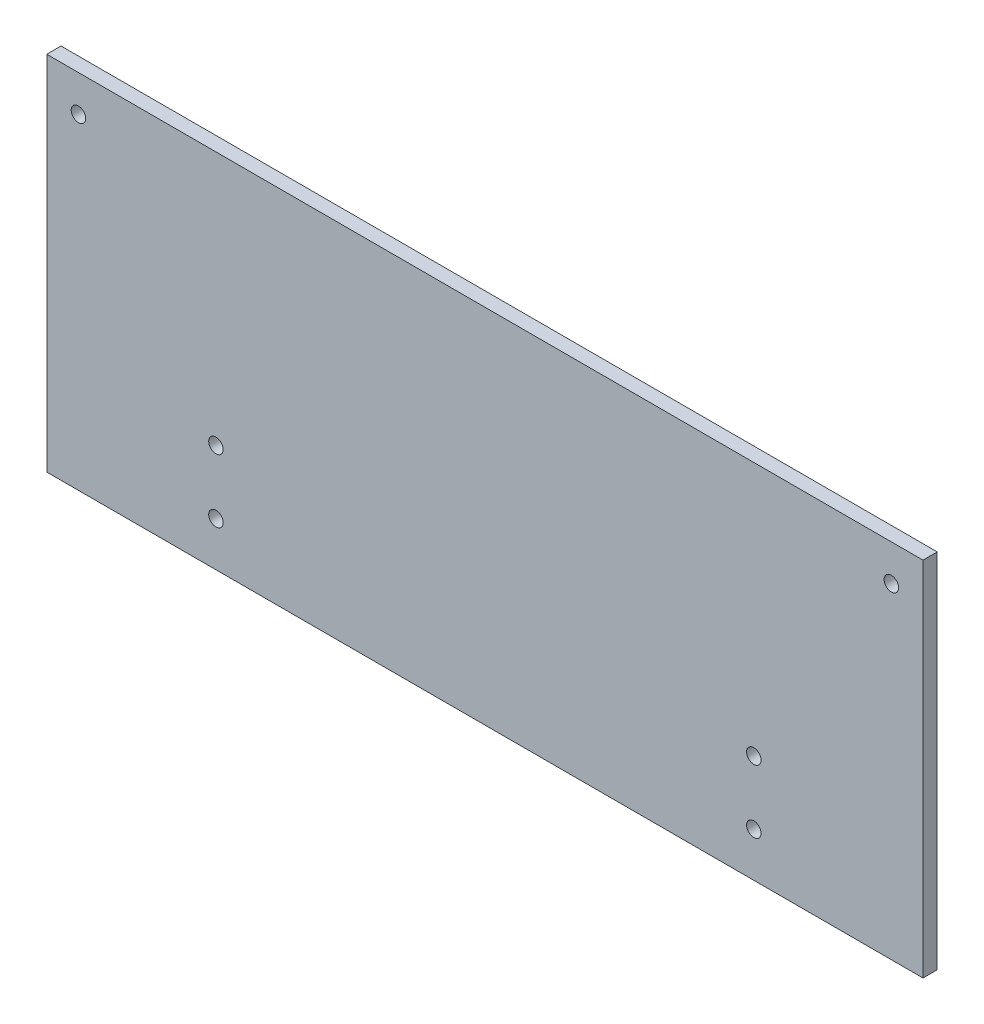
from build123d import *

# Parameters (mm, degrees)
SKETCH1_R           = 2.032
BOSS_EXTRUDE1_DEPTH = 4


with BuildPart() as part:
    # Sketch1 → Boss-Extrude1 (new body)
    with BuildSketch(Plane.XY):
        Polygon((4, 101.6), (250, 101.6), (250, 0), (127, 0), (4, 0), align=None)
        with Locations(Location((51.498, 12.446, 0), (0, 0, 180))):
            Circle(SKETCH1_R, mode=Mode.SUBTRACT)
        with Locations(Location((51.498, 30.226, 0), (0, 0, 180))):
            Circle(SKETCH1_R, mode=Mode.SUBTRACT)
        with Locations((202.502, 30.226)):
            Circle(SKETCH1_R, mode=Mode.SUBTRACT)
        with Locations((202.502, 12.446)):
            Circle(SKETCH1_R, mode=Mode.SUBTRACT)
        with Locations((241.11, 91.44)):
            Circle(SKETCH1_R, mode=Mode.SUBTRACT)
        with Locations((12.89, 91.44)):
            Circle(SKETCH1_R, mode=Mode.SUBTRACT)
    extrude(amount=BOSS_EXTRUDE1_DEPTH)


solid = part.part
